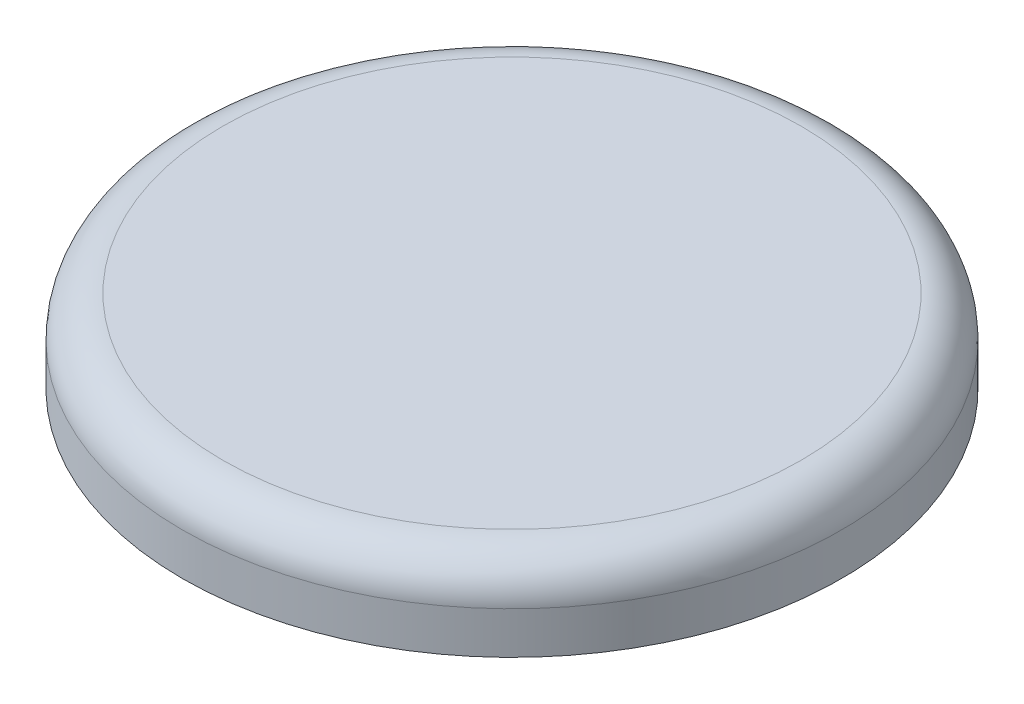
from build123d import *


with BuildPart() as part:
    # Sketch1 → Revolve1 (revolve)
    with BuildSketch(Plane.XY, mode=Mode.PRIVATE) as revolve1_sk:
        with BuildLine():
            Line((0, 0), (-100.33, 0))
            ThreePointArc((-100.33, 0), (-106.616179285, -2.603820715), (-109.22, -8.89))
            Line((-109.22, -8.89), (-109.22, -10.795))
            Line((-109.22, -10.795), (-111.76, -10.795))
            Line((-111.76, -10.795), (-111.76, -23.495))
            Line((-111.76, -23.495), (-114.3, -23.495))
            Line((-114.3, -23.495), (-114.3, -8.89))
            ThreePointArc((-114.3, -8.89), (-110.208281733, 0.988281733), (-100.33, 5.08))
            Line((-100.33, 5.08), (0, 5.08))
            Line((0, 5.08), (0, 0))
        make_face()
    revolve(revolve1_sk.sketch.rotate(Axis((0, 0, 0), (0, 1, 0)), 270), axis=Axis((0, 0, 0), (0, 1, 0)))


solid = part.part
